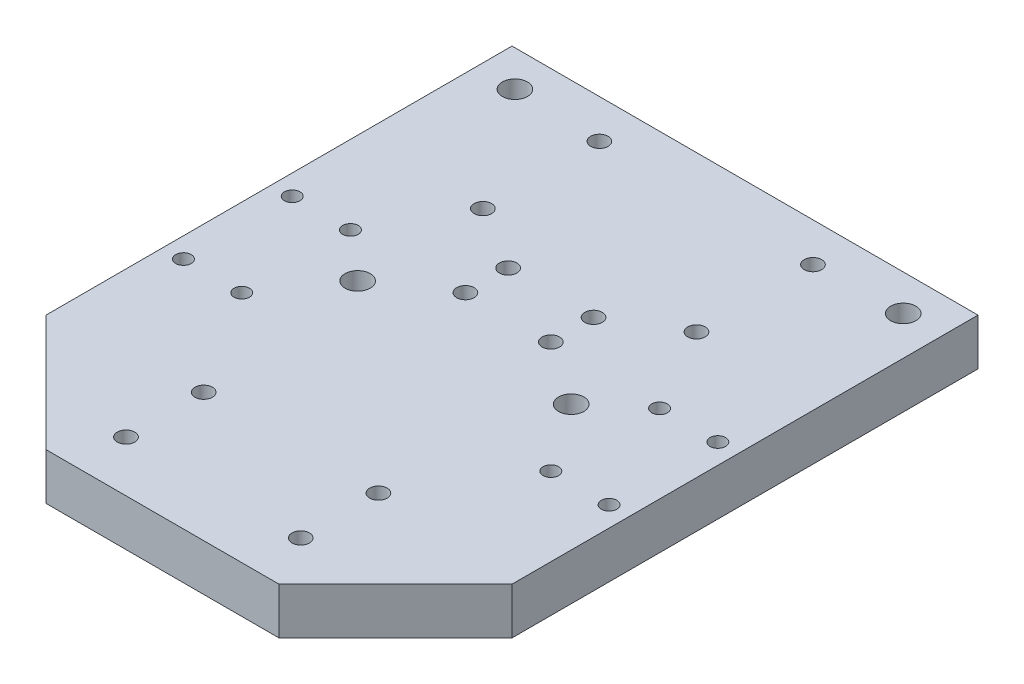
from build123d import *

# Parameters (mm, degrees)
SALIENTE_EXTRUIR1_DEPTH      = 120
SALIENTE_EXTRUIR1_DEPTH_BACK = 120
CROQUIS1_W                   = 300
CROQUIS1_H                   = 24
CORTAR_EXTRUIR1_REACH        = 280.345
CROQUIS2_R                   = 4.5
CROQUIS3_R                   = 7
CORTAR_EXTRUIR2_DEPTH        = 9
CHAFL_N1_SIZE                = 60
CORTAR_EXTRUIR3_REACH        = 280.345
CROQUIS4_R                   = 6.5
CORTAR_EXTRUIR4_REACH        = 280.345
CROQUIS5_R                   = 4
CROQUIS6_R                   = 4.5
CORTAR_EXTRUIR5_DEPTH        = 30
CROQUIS7_R                   = 7
CORTAR_EXTRUIR6_DEPTH        = 9
CORTAR_EXTRUIR7_REACH        = 280.345
CROQUIS8_R                   = 4.5
CROQUIS9_R                   = 7
CORTAR_EXTRUIR8_DEPTH        = 9


with BuildPart() as part:
    # Croquis1 → Saliente-Extruir1 (new, two sides: drawn at the far end of the back side and taken through both)
    with BuildSketch(Plane(origin=(0, 0, 0), x_dir=(0, 0, -1), z_dir=(1, 0, 0)).offset(-SALIENTE_EXTRUIR1_DEPTH_BACK)):
        with Locations((-100, -12)):
            Rectangle(CROQUIS1_W, CROQUIS1_H)
    extrude(amount=SALIENTE_EXTRUIR1_DEPTH + SALIENTE_EXTRUIR1_DEPTH_BACK)

    # Croquis2 → Cortar-Extruir1 (cut, up to next)
    with BuildSketch(Plane(origin=(0, 0, 0), x_dir=(1, 0, 0), z_dir=(0, 1, 0)), mode=Mode.PRIVATE) as cortar_extruir1_sk1:
        with Locations((45, -183.8)):
            Circle(CROQUIS2_R)
    cortar_extruir1_tool1 = extrude(cortar_extruir1_sk1.sketch, amount=-CORTAR_EXTRUIR1_REACH, mode=Mode.PRIVATE) & part.part
    # Croquis2 → Cortar-Extruir1 (cut, up to next)
    with BuildSketch(Plane(origin=(0, 0, 0), x_dir=(1, 0, 0), z_dir=(0, 1, 0)), mode=Mode.PRIVATE) as cortar_extruir1_sk2:
        with Locations((45, -223.8)):
            Circle(CROQUIS2_R)
    cortar_extruir1_tool2 = extrude(cortar_extruir1_sk2.sketch, amount=-CORTAR_EXTRUIR1_REACH, mode=Mode.PRIVATE) & part.part
    # Croquis2 → Cortar-Extruir1 (cut, up to next)
    with BuildSketch(Plane(origin=(0, 0, 0), x_dir=(1, 0, 0), z_dir=(0, 1, 0)), mode=Mode.PRIVATE) as cortar_extruir1_sk3:
        with Locations((-45, -183.8)):
            Circle(CROQUIS2_R)
    cortar_extruir1_tool3 = extrude(cortar_extruir1_sk3.sketch, amount=-CORTAR_EXTRUIR1_REACH, mode=Mode.PRIVATE) & part.part
    # Croquis2 → Cortar-Extruir1 (cut, up to next)
    with BuildSketch(Plane(origin=(0, 0, 0), x_dir=(1, 0, 0), z_dir=(0, 1, 0)), mode=Mode.PRIVATE) as cortar_extruir1_sk4:
        with Locations((-45, -223.8)):
            Circle(CROQUIS2_R)
    cortar_extruir1_tool4 = extrude(cortar_extruir1_sk4.sketch, amount=-CORTAR_EXTRUIR1_REACH, mode=Mode.PRIVATE) & part.part
    add(cortar_extruir1_tool1.solids().sort_by_distance((45, 0, 183.8))[0], mode=Mode.SUBTRACT)
    add(cortar_extruir1_tool2.solids().sort_by_distance((45, 0, 223.8))[0], mode=Mode.SUBTRACT)
    add(cortar_extruir1_tool3.solids().sort_by_distance((-45, 0, 183.8))[0], mode=Mode.SUBTRACT)
    add(cortar_extruir1_tool4.solids().sort_by_distance((-45, 0, 223.8))[0], mode=Mode.SUBTRACT)

    # Croquis3 → Cortar-Extruir2 (cut)
    with BuildSketch(Plane.XZ.offset(24)):
        with Locations((-45, 223.8)):
            Circle(CROQUIS3_R)
        with Locations((-45, 183.8)):
            Circle(CROQUIS3_R)
        with Locations((45, 223.8)):
            Circle(CROQUIS3_R)
        with Locations((45, 183.8)):
            Circle(CROQUIS3_R)
    extrude(amount=-CORTAR_EXTRUIR2_DEPTH, mode=Mode.SUBTRACT)

    # Chaflán1
    chafl_n1_edges = [part.edges().sort_by_distance(p)[0] for p in [
        (120, -12, 250),
        (-120, -12, 250),
    ]]
    chamfer(chafl_n1_edges, length=CHAFL_N1_SIZE)

    # Croquis4 → Cortar-Extruir3 (cut, up to next)
    with BuildSketch(Plane(origin=(0, 0, 0), x_dir=(1, 0, 0), z_dir=(0, 1, 0)), mode=Mode.PRIVATE) as cortar_extruir3_sk1:
        with Locations((100, 31.5)):
            Circle(CROQUIS4_R)
    cortar_extruir3_tool1 = extrude(cortar_extruir3_sk1.sketch, amount=-CORTAR_EXTRUIR3_REACH, mode=Mode.PRIVATE) & part.part
    # Croquis4 → Cortar-Extruir3 (cut, up to next)
    with BuildSketch(Plane(origin=(0, 0, 0), x_dir=(1, 0, 0), z_dir=(0, 1, 0)), mode=Mode.PRIVATE) as cortar_extruir3_sk2:
        with Locations((-100, 31.5)):
            Circle(CROQUIS4_R)
    cortar_extruir3_tool2 = extrude(cortar_extruir3_sk2.sketch, amount=-CORTAR_EXTRUIR3_REACH, mode=Mode.PRIVATE) & part.part
    # Croquis4 → Cortar-Extruir3 (cut, up to next)
    with BuildSketch(Plane(origin=(0, 0, 0), x_dir=(1, 0, 0), z_dir=(0, 1, 0)), mode=Mode.PRIVATE) as cortar_extruir3_sk3:
        with Locations((55, -94.5)):
            Circle(CROQUIS4_R)
    cortar_extruir3_tool3 = extrude(cortar_extruir3_sk3.sketch, amount=-CORTAR_EXTRUIR3_REACH, mode=Mode.PRIVATE) & part.part
    # Croquis4 → Cortar-Extruir3 (cut, up to next)
    with BuildSketch(Plane(origin=(0, 0, 0), x_dir=(1, 0, 0), z_dir=(0, 1, 0)), mode=Mode.PRIVATE) as cortar_extruir3_sk4:
        with Locations((-55, -94.5)):
            Circle(CROQUIS4_R)
    cortar_extruir3_tool4 = extrude(cortar_extruir3_sk4.sketch, amount=-CORTAR_EXTRUIR3_REACH, mode=Mode.PRIVATE) & part.part
    add(cortar_extruir3_tool1.solids().sort_by_distance((100, 0, -31.5))[0], mode=Mode.SUBTRACT)
    add(cortar_extruir3_tool2.solids().sort_by_distance((-100, 0, -31.5))[0], mode=Mode.SUBTRACT)
    add(cortar_extruir3_tool3.solids().sort_by_distance((55, 0, 94.5))[0], mode=Mode.SUBTRACT)
    add(cortar_extruir3_tool4.solids().sort_by_distance((-55, 0, 94.5))[0], mode=Mode.SUBTRACT)

    # Croquis5 → Cortar-Extruir4 (cut, up to next)
    with BuildSketch(Plane(origin=(0, 0, 0), x_dir=(1, 0, 0), z_dir=(0, 1, 0)), mode=Mode.PRIVATE) as cortar_extruir4_sk1:
        with Locations((79.6, -129.6)):
            Circle(CROQUIS5_R)
    cortar_extruir4_tool1 = extrude(cortar_extruir4_sk1.sketch, amount=-CORTAR_EXTRUIR4_REACH, mode=Mode.PRIVATE) & part.part
    # Croquis5 → Cortar-Extruir4 (cut, up to next)
    with BuildSketch(Plane(origin=(0, 0, 0), x_dir=(1, 0, 0), z_dir=(0, 1, 0)), mode=Mode.PRIVATE) as cortar_extruir4_sk2:
        with Locations((109.6, -129.6)):
            Circle(CROQUIS5_R)
    cortar_extruir4_tool2 = extrude(cortar_extruir4_sk2.sketch, amount=-CORTAR_EXTRUIR4_REACH, mode=Mode.PRIVATE) & part.part
    # Croquis5 → Cortar-Extruir4 (cut, up to next)
    with BuildSketch(Plane(origin=(0, 0, 0), x_dir=(1, 0, 0), z_dir=(0, 1, 0)), mode=Mode.PRIVATE) as cortar_extruir4_sk3:
        with Locations((109.6, -73.6)):
            Circle(CROQUIS5_R)
    cortar_extruir4_tool3 = extrude(cortar_extruir4_sk3.sketch, amount=-CORTAR_EXTRUIR4_REACH, mode=Mode.PRIVATE) & part.part
    # Croquis5 → Cortar-Extruir4 (cut, up to next)
    with BuildSketch(Plane(origin=(0, 0, 0), x_dir=(1, 0, 0), z_dir=(0, 1, 0)), mode=Mode.PRIVATE) as cortar_extruir4_sk4:
        with Locations((79.6, -73.6)):
            Circle(CROQUIS5_R)
    cortar_extruir4_tool4 = extrude(cortar_extruir4_sk4.sketch, amount=-CORTAR_EXTRUIR4_REACH, mode=Mode.PRIVATE) & part.part
    # Croquis5 → Cortar-Extruir4 (cut, up to next)
    with BuildSketch(Plane(origin=(0, 0, 0), x_dir=(1, 0, 0), z_dir=(0, 1, 0)), mode=Mode.PRIVATE) as cortar_extruir4_sk5:
        with Locations((-109.6, -129.6)):
            Circle(CROQUIS5_R)
    cortar_extruir4_tool5 = extrude(cortar_extruir4_sk5.sketch, amount=-CORTAR_EXTRUIR4_REACH, mode=Mode.PRIVATE) & part.part
    # Croquis5 → Cortar-Extruir4 (cut, up to next)
    with BuildSketch(Plane(origin=(0, 0, 0), x_dir=(1, 0, 0), z_dir=(0, 1, 0)), mode=Mode.PRIVATE) as cortar_extruir4_sk6:
        with Locations((-79.6, -129.6)):
            Circle(CROQUIS5_R)
    cortar_extruir4_tool6 = extrude(cortar_extruir4_sk6.sketch, amount=-CORTAR_EXTRUIR4_REACH, mode=Mode.PRIVATE) & part.part
    # Croquis5 → Cortar-Extruir4 (cut, up to next)
    with BuildSketch(Plane(origin=(0, 0, 0), x_dir=(1, 0, 0), z_dir=(0, 1, 0)), mode=Mode.PRIVATE) as cortar_extruir4_sk7:
        with Locations((-109.6, -73.6)):
            Circle(CROQUIS5_R)
    cortar_extruir4_tool7 = extrude(cortar_extruir4_sk7.sketch, amount=-CORTAR_EXTRUIR4_REACH, mode=Mode.PRIVATE) & part.part
    # Croquis5 → Cortar-Extruir4 (cut, up to next)
    with BuildSketch(Plane(origin=(0, 0, 0), x_dir=(1, 0, 0), z_dir=(0, 1, 0)), mode=Mode.PRIVATE) as cortar_extruir4_sk8:
        with Locations((-79.6, -73.6)):
            Circle(CROQUIS5_R)
    cortar_extruir4_tool8 = extrude(cortar_extruir4_sk8.sketch, amount=-CORTAR_EXTRUIR4_REACH, mode=Mode.PRIVATE) & part.part
    add(cortar_extruir4_tool1.solids().sort_by_distance((79.6, 0, 129.6))[0], mode=Mode.SUBTRACT)
    add(cortar_extruir4_tool2.solids().sort_by_distance((109.6, 0, 129.6))[0], mode=Mode.SUBTRACT)
    add(cortar_extruir4_tool3.solids().sort_by_distance((109.6, 0, 73.6))[0], mode=Mode.SUBTRACT)
    add(cortar_extruir4_tool4.solids().sort_by_distance((79.6, 0, 73.6))[0], mode=Mode.SUBTRACT)
    add(cortar_extruir4_tool5.solids().sort_by_distance((-109.6, 0, 129.6))[0], mode=Mode.SUBTRACT)
    add(cortar_extruir4_tool6.solids().sort_by_distance((-79.6, 0, 129.6))[0], mode=Mode.SUBTRACT)
    add(cortar_extruir4_tool7.solids().sort_by_distance((-109.6, 0, 73.6))[0], mode=Mode.SUBTRACT)
    add(cortar_extruir4_tool8.solids().sort_by_distance((-79.6, 0, 73.6))[0], mode=Mode.SUBTRACT)

    # Croquis6 → Cortar-Extruir5 (cut)
    with BuildSketch(Plane(origin=(0, 0, 0), x_dir=(1, 0, 0), z_dir=(0, 1, 0))):
        with Locations((-55, -30)):
            Circle(CROQUIS6_R)
        with Locations((-55, 30)):
            Circle(CROQUIS6_R)
        with Locations((55, 30)):
            Circle(CROQUIS6_R)
        with Locations((55, -30)):
            Circle(CROQUIS6_R)
    extrude(amount=-CORTAR_EXTRUIR5_DEPTH, mode=Mode.SUBTRACT)

    # Croquis7 → Cortar-Extruir6 (cut)
    with BuildSketch(Plane.XZ.offset(24)):
        with Locations((55, 30)):
            Circle(CROQUIS7_R)
        with Locations((55, -30)):
            Circle(CROQUIS7_R)
        with Locations((-55, 30)):
            Circle(CROQUIS7_R)
        with Locations((-55, -30)):
            Circle(CROQUIS7_R)
    extrude(amount=-CORTAR_EXTRUIR6_DEPTH, mode=Mode.SUBTRACT)

    # Croquis8 → Cortar-Extruir7 (cut, up to next)
    with BuildSketch(Plane(origin=(0, 0, 0), x_dir=(1, 0, 0), z_dir=(0, 1, 0)), mode=Mode.PRIVATE) as cortar_extruir7_sk1:
        with Locations((-22, -50)):
            Circle(CROQUIS8_R)
    cortar_extruir7_tool1 = extrude(cortar_extruir7_sk1.sketch, amount=-CORTAR_EXTRUIR7_REACH, mode=Mode.PRIVATE) & part.part
    # Croquis8 → Cortar-Extruir7 (cut, up to next)
    with BuildSketch(Plane(origin=(0, 0, 0), x_dir=(1, 0, 0), z_dir=(0, 1, 0)), mode=Mode.PRIVATE) as cortar_extruir7_sk2:
        with Locations((-22, -72)):
            Circle(CROQUIS8_R)
    cortar_extruir7_tool2 = extrude(cortar_extruir7_sk2.sketch, amount=-CORTAR_EXTRUIR7_REACH, mode=Mode.PRIVATE) & part.part
    # Croquis8 → Cortar-Extruir7 (cut, up to next)
    with BuildSketch(Plane(origin=(0, 0, 0), x_dir=(1, 0, 0), z_dir=(0, 1, 0)), mode=Mode.PRIVATE) as cortar_extruir7_sk3:
        with Locations((22, -72)):
            Circle(CROQUIS8_R)
    cortar_extruir7_tool3 = extrude(cortar_extruir7_sk3.sketch, amount=-CORTAR_EXTRUIR7_REACH, mode=Mode.PRIVATE) & part.part
    # Croquis8 → Cortar-Extruir7 (cut, up to next)
    with BuildSketch(Plane(origin=(0, 0, 0), x_dir=(1, 0, 0), z_dir=(0, 1, 0)), mode=Mode.PRIVATE) as cortar_extruir7_sk4:
        with Locations((22, -50)):
            Circle(CROQUIS8_R)
    cortar_extruir7_tool4 = extrude(cortar_extruir7_sk4.sketch, amount=-CORTAR_EXTRUIR7_REACH, mode=Mode.PRIVATE) & part.part
    add(cortar_extruir7_tool1.solids().sort_by_distance((-22, 0, 50))[0], mode=Mode.SUBTRACT)
    add(cortar_extruir7_tool2.solids().sort_by_distance((-22, 0, 72))[0], mode=Mode.SUBTRACT)
    add(cortar_extruir7_tool3.solids().sort_by_distance((22, 0, 72))[0], mode=Mode.SUBTRACT)
    add(cortar_extruir7_tool4.solids().sort_by_distance((22, 0, 50))[0], mode=Mode.SUBTRACT)

    # Croquis9 → Cortar-Extruir8 (cut)
    with BuildSketch(Plane.XZ.offset(24)):
        with Locations((22, 50)):
            Circle(CROQUIS9_R)
        with Locations((22, 72)):
            Circle(CROQUIS9_R)
        with Locations((-22, 72)):
            Circle(CROQUIS9_R)
        with Locations((-22, 50)):
            Circle(CROQUIS9_R)
    extrude(amount=-CORTAR_EXTRUIR8_DEPTH, mode=Mode.SUBTRACT)


solid = part.part
